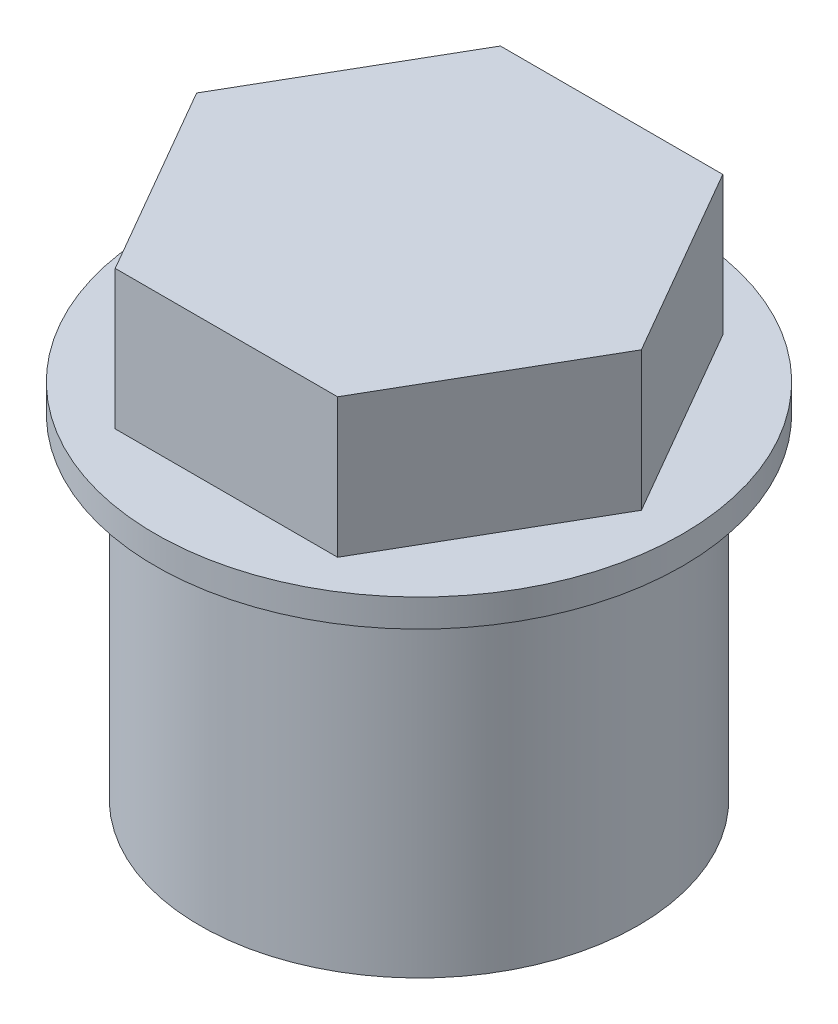
from build123d import *

# Parameters (mm, degrees)
CUT_EXTRUDE1_START = -6.35
CUT_EXTRUDE1_DEPTH = 6.35


with BuildPart() as part:
    # Sketch1 → Revolve1 (revolve)
    with BuildSketch(Plane.XY):
        Polygon((0, 0), (0, 15.24), (0, 22.86), (10.16, 22.86), (10.16, 16.51), (12.0396, 16.51), (12.0396, 15.24), (10.0076, 15.24), (10.0076, 0), align=None)
    revolve(axis=Axis((0, 0, 0), (0, 1, 0)))

    # Sketch2 → Cut-Extrude1 (cut)
    with BuildSketch(Plane(origin=(0, 22.86, 0), x_dir=(1, 0, 0), z_dir=(0, 1, 0)).offset(CUT_EXTRUDE1_START)):
        with BuildLine():
            ThreePointArc((5.08, 8.798818102), (0, 10.16), (-5.08, 8.798818102))
            Line((-5.08, 8.798818102), (5.08, 8.798818102))
        make_face()
        with BuildLine():
            Line((-10.16, 0), (-5.08, 8.798818102))
            ThreePointArc((-5.08, 8.798818102), (-8.798818102, 5.08), (-10.16, 0))
        make_face()
        with BuildLine():
            Line((-5.08, -8.798818102), (-10.16, 0))
            ThreePointArc((-10.16, 0), (-8.798818102, -5.08), (-5.08, -8.798818102))
        make_face()
        with BuildLine():
            ThreePointArc((10.16, 0), (8.798818102, 5.08), (5.08, 8.798818102))
            Line((5.08, 8.798818102), (10.16, 0))
        make_face()
        with BuildLine():
            Line((5.08, -8.798818102), (-5.08, -8.798818102))
            ThreePointArc((-5.08, -8.798818102), (0, -10.16), (5.08, -8.798818102))
        make_face()
        with BuildLine():
            ThreePointArc((5.08, -8.798818102), (8.798818102, -5.08), (10.16, 0))
            Line((10.16, 0), (5.08, -8.798818102))
        make_face()
    extrude(amount=CUT_EXTRUDE1_DEPTH, mode=Mode.SUBTRACT)


solid = part.part
